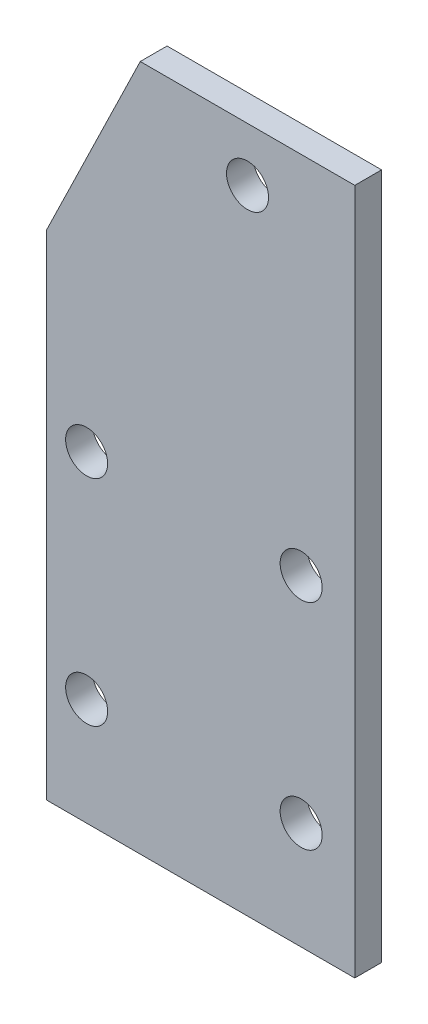
from build123d import *

# Parameters (mm, degrees)
SKETCH1_R           = 2.4892
BOSS_EXTRUDE1_DEPTH = 3.175


with BuildPart() as part:
    # Sketch1 → Boss-Extrude1 (new body)
    with BuildSketch(Plane.XY):
        Polygon((19.05, 33.02), (19.05, 55.88), (-6.35, 55.88), (-17.4625, 33.02), (-17.4625, -25.4), (19.05, -25.4), align=None)
        with Locations((-12.7, 12.7)):
            Circle(SKETCH1_R, mode=Mode.SUBTRACT)
        with Locations((-12.7, -12.7)):
            Circle(SKETCH1_R, mode=Mode.SUBTRACT)
        with Locations((12.7, 12.7)):
            Circle(SKETCH1_R, mode=Mode.SUBTRACT)
        with Locations((12.7, -12.7)):
            Circle(SKETCH1_R, mode=Mode.SUBTRACT)
        with Locations((6.35, 49.53)):
            Circle(SKETCH1_R, mode=Mode.SUBTRACT)
    extrude(amount=BOSS_EXTRUDE1_DEPTH)


solid = part.part
